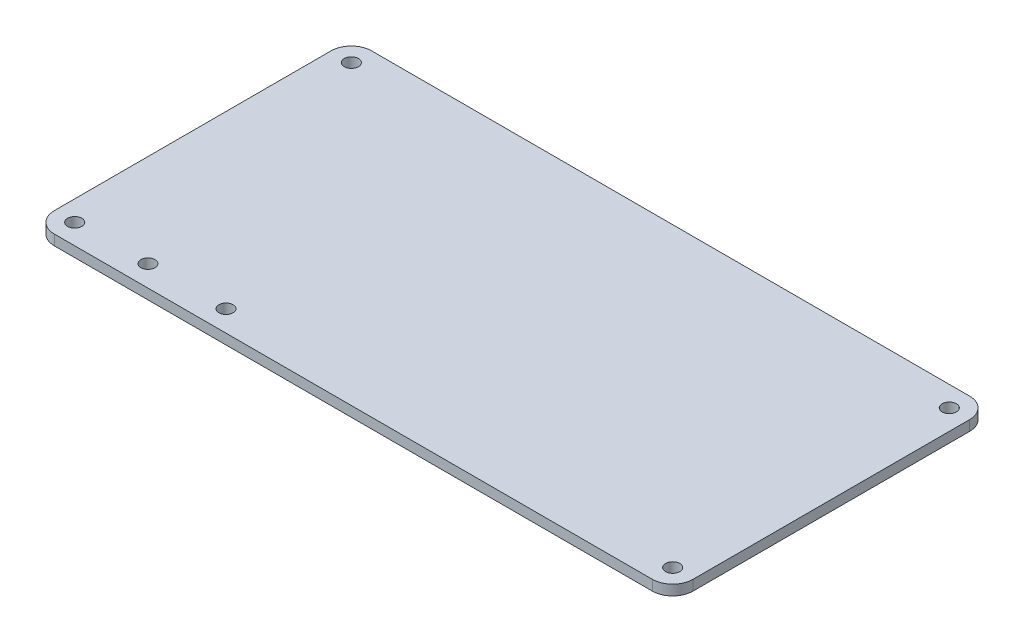
from build123d import *

# Parameters (mm, degrees)
SKETCH1_R           = 1.11125
BOSS_EXTRUDE1_DEPTH = 1.6
SKETCH2_R           = 1.1
CUT_EXTRUDE1_DEPTH  = 112.332268121


with BuildPart() as part:
    # Sketch1 → Boss-Extrude1 (new body)
    with BuildSketch(Plane(origin=(0, 0, 0), x_dir=(1, 0, 0), z_dir=(0, 1, 0))):
        with BuildLine():
            Line((3.175, 0), (96.52, 0))
            ThreePointArc((96.52, 0), (98.76506403, 0.92993597), (99.695, 3.175))
            Line((99.695, 3.175), (99.695, 46.355))
            ThreePointArc((99.695, 46.355), (98.76506403, 48.60006403), (96.52, 49.53))
            Line((96.52, 49.53), (3.175, 49.53))
            ThreePointArc((3.175, 49.53), (0.92993597, 48.60006403), (0, 46.355))
            Line((0, 46.355), (0, 3.175))
            ThreePointArc((0, 3.175), (0.92993597, 0.92993597), (3.175, 0))
        make_face()
        with Locations(Location((3.175, 46.355, 0), (0, 0, 270))):
            Circle(SKETCH1_R, mode=Mode.SUBTRACT)
        with Locations(Location((96.52, 46.355, 0), (0, 0, 90))):
            Circle(SKETCH1_R, mode=Mode.SUBTRACT)
        with Locations(Location((96.52, 3.175, 0), (0, 0, 270))):
            Circle(SKETCH1_R, mode=Mode.SUBTRACT)
        with Locations(Location((3.175, 3.175, 0), (0, 0, 90))):
            Circle(SKETCH1_R, mode=Mode.SUBTRACT)
    extrude(amount=BOSS_EXTRUDE1_DEPTH)

    # Sketch2 → Cut-Extrude1 (cut, through all)
    with BuildSketch(Plane(origin=(0, 1.6, 0), x_dir=(1, 0, 0), z_dir=(0, 1, 0))):
        with Locations(Location((14.478473279, 3.302, 0), (0, 0, 270))):
            Circle(SKETCH2_R)
        with Locations(Location((26.668473279, 3.302, 0), (0, 0, 270))):
            Circle(SKETCH2_R)
    extrude(amount=-CUT_EXTRUDE1_DEPTH, mode=Mode.SUBTRACT)


solid = part.part
